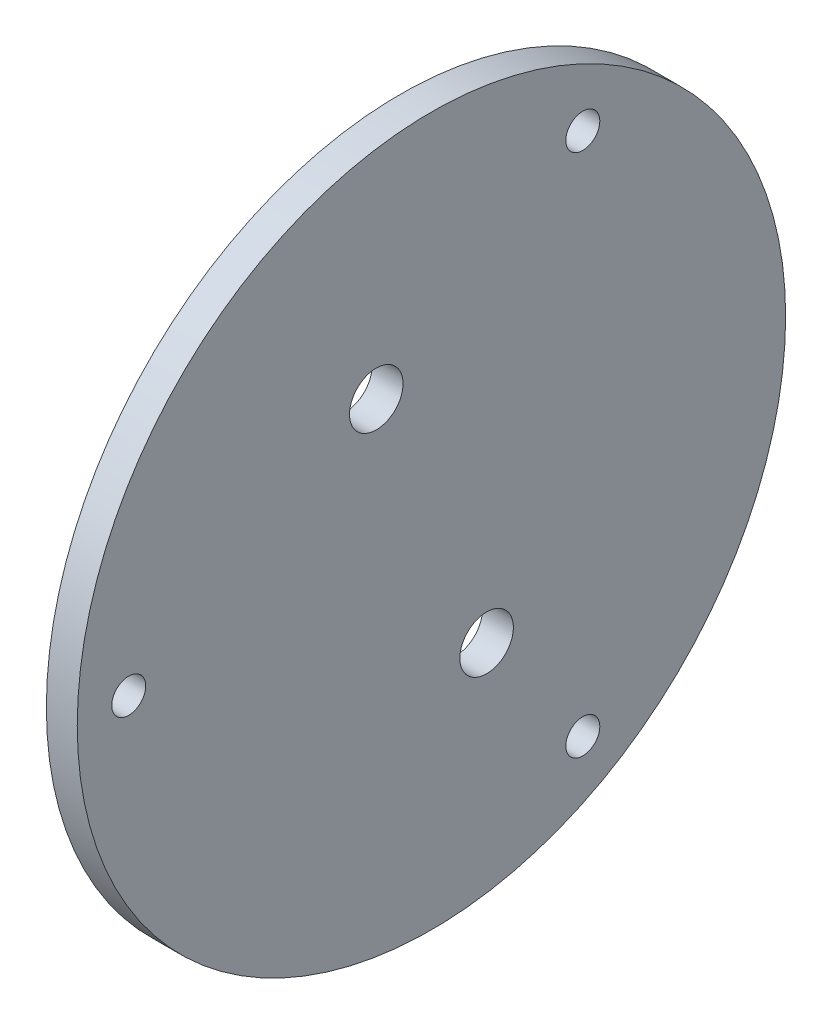
from build123d import *

# Parameters (mm, degrees)
AXIAL_PROFILE_MM_W     = 3
AXIAL_PROFILE_MM_H     = 34.4
AXIAL_HOLES_DEPTH      = 167.945530039
AXIAL_HOLES_DEPTH_BACK = 167.945530039
SKETCH2_R              = 2.6
SKETCH2_R_2            = 1.65


with BuildPart() as part:
    # Axial profile (mm) → Full revolution (revolve)
    with BuildSketch(Plane.XY, mode=Mode.PRIVATE) as full_revolution_sk:
        with Locations((158.2, 17.2)):
            Rectangle(AXIAL_PROFILE_MM_W, AXIAL_PROFILE_MM_H)
    revolve(full_revolution_sk.sketch.rotate(Axis((-110, 0, 0), (1, 0, 0)), 90), axis=Axis((-110, 0, 0), (1, 0, 0)))

    # Sketch2 → Axial holes (cut, two sides: drawn at the far end of the back side and taken through both)
    with BuildSketch(Plane(origin=(0, 0, 0), x_dir=(0, 0, -1), z_dir=(1, 0, 0)).offset(-AXIAL_HOLES_DEPTH_BACK)):
        with Locations((-5.357568053, 12.934313455)):
            Circle(SKETCH2_R)
        with Locations((5.357568053, -12.934313455)):
            Circle(SKETCH2_R)
        with Locations((-29.4, 0)):
            Circle(SKETCH2_R_2)
        with Locations((14.7, -25.461146871)):
            Circle(SKETCH2_R_2)
        with Locations((14.7, 25.461146871)):
            Circle(SKETCH2_R_2)
    extrude(amount=AXIAL_HOLES_DEPTH + AXIAL_HOLES_DEPTH_BACK, mode=Mode.SUBTRACT)


solid = part.part
